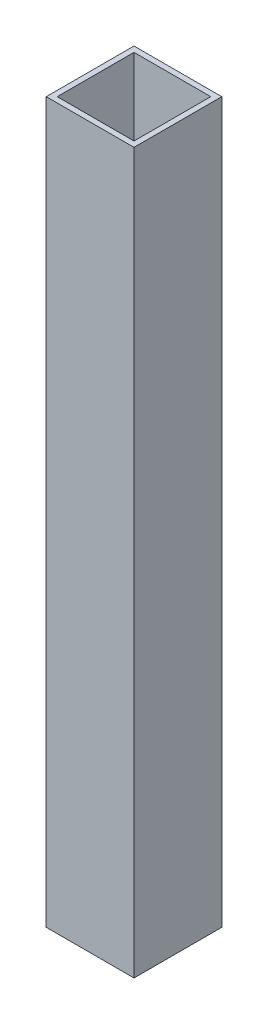
from build123d import *

# Parameters (mm, degrees)
SKETCH3_W           = 50.8
SKETCH3_H           = 50.8
SKETCH3_W_2         = 44.45
SKETCH3_H_2         = 44.45
BOSS_EXTRUDE3_DEPTH = 416.4076


with BuildPart() as part:
    # Sketch3 → Boss-Extrude3 (new body)
    with BuildSketch(Plane(origin=(0, 0, 0), x_dir=(1, 0, 0), z_dir=(0, 1, 0))):
        Rectangle(SKETCH3_W, SKETCH3_H)
        Rectangle(SKETCH3_W_2, SKETCH3_H_2, mode=Mode.SUBTRACT)
    extrude(amount=BOSS_EXTRUDE3_DEPTH)


solid = part.part
